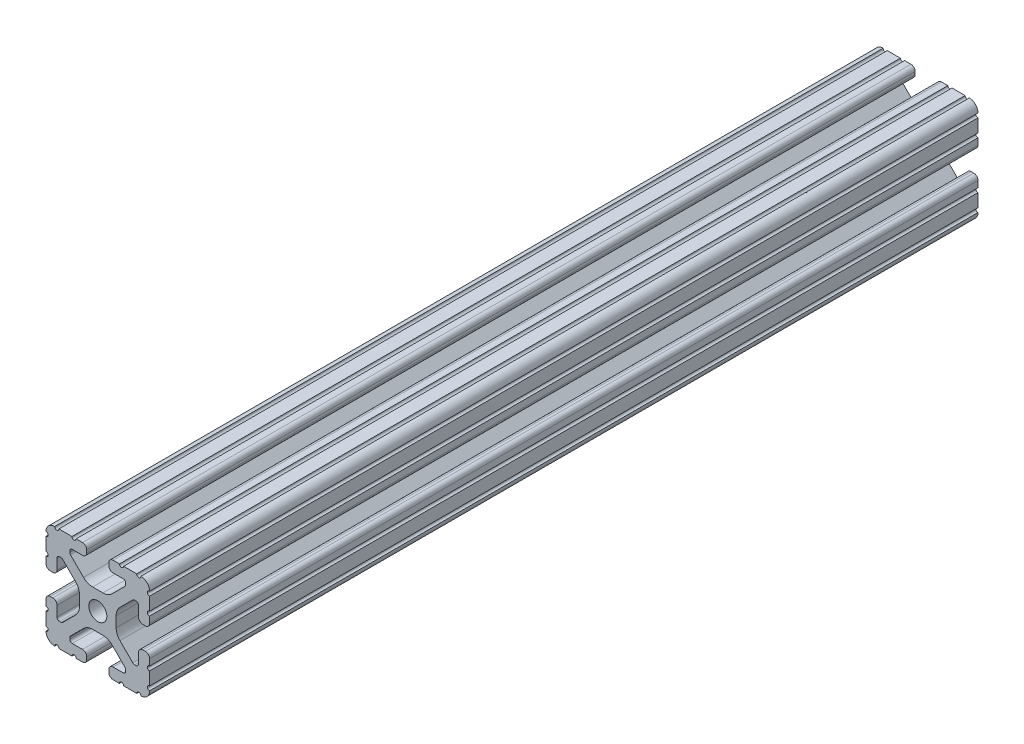
from build123d import *

# Parameters (mm, degrees)
SKETCH1_R           = 3.3274
BOSS_EXTRUDE1_DEPTH = 152.4


with BuildPart() as part:
    # Sketch1 → Boss-Extrude1 (new, symmetric)
    with BuildSketch(Plane.XY):
        with BuildLine():
            Line((-10.287, 13.552357131), (-10.287, 14.0843))
            ThreePointArc((-10.287, 14.0843), (-10.022898185, 14.721898185), (-9.3853, 14.986))
            Line((-9.3853, 14.986), (-5.617617549, 14.986))
            ThreePointArc((-5.617617549, 14.986), (-4.519044045, 15.441044045), (-4.064, 16.539617549))
            Line((-4.064, 16.539617549), (-4.064, 17.496382451))
            ThreePointArc((-4.064, 17.496382451), (-4.519044045, 18.594955955), (-5.617617549, 19.05))
            Line((-5.617617549, 19.05), (-7.974178704, 19.05))
            ThreePointArc((-7.974178704, 19.05), (-8.736178704, 18.288), (-9.498178704, 19.05))
            Line((-9.498178704, 19.05), (-14.327719207, 19.05))
            ThreePointArc((-14.327719207, 19.05), (-15.087603123, 18.231251131), (-15.847487039, 19.05))
            ThreePointArc((-15.847487039, 19.05), (-18.120176289, 18.120192083), (-19.05, 15.847509295))
            ThreePointArc((-19.05, 15.847509295), (-18.231250992, 15.08762539), (-19.05, 14.327741484))
            Line((-19.05, 14.327741484), (-19.05, 9.496091471))
            ThreePointArc((-19.05, 9.496091471), (-18.231250992, 8.736207565), (-19.05, 7.97632366))
            Line((-19.05, 7.97632366), (-19.05, 5.617617549))
            ThreePointArc((-19.05, 5.617617549), (-18.594955955, 4.519044045), (-17.496382451, 4.064))
            Line((-17.496382451, 4.064), (-16.539617549, 4.064))
            ThreePointArc((-16.539617549, 4.064), (-15.441044045, 4.519044045), (-14.986, 5.617617549))
            Line((-14.986, 5.617617549), (-14.986, 9.385342516))
            ThreePointArc((-14.986, 9.385342516), (-14.721898185, 10.022940701), (-14.0843, 10.287042516))
            Line((-14.0843, 10.287042516), (-13.516042086, 10.287042516))
            ThreePointArc((-13.516042086, 10.287042516), (-13.170975923, 10.218404478), (-12.878443117, 10.022939917))
            Line((-12.878443117, 10.022939917), (-8.14758008, 5.292065243))
            ThreePointArc((-8.14758008, 5.292065243), (-7.117955879, 3.751120653), (-6.7564, 1.933453584))
            Line((-6.7564, 1.933453584), (-6.7564, -1.933453584))
            ThreePointArc((-6.7564, -1.933453584), (-7.117955879, -3.751120653), (-8.14758008, -5.292065243))
            Line((-8.14758008, -5.292065243), (-12.878443117, -10.022939917))
            ThreePointArc((-12.878443117, -10.022939917), (-13.170975923, -10.218404478), (-13.516042086, -10.287042516))
            Line((-13.516042086, -10.287042516), (-14.0843, -10.287042516))
            ThreePointArc((-14.0843, -10.287042516), (-14.721898185, -10.022940701), (-14.986, -9.385342516))
            Line((-14.986, -9.385342516), (-14.986, -5.617617549))
            ThreePointArc((-14.986, -5.617617549), (-15.441044045, -4.519044045), (-16.539617549, -4.064))
            Line((-16.539617549, -4.064), (-17.496382451, -4.064))
            ThreePointArc((-17.496382451, -4.064), (-18.594955955, -4.519044045), (-19.05, -5.617617549))
            Line((-19.05, -5.617617549), (-19.05, -7.976318491))
            ThreePointArc((-19.05, -7.976318491), (-18.231250992, -8.736202396), (-19.05, -9.496086302))
            Line((-19.05, -9.496086302), (-19.05, -14.32774291))
            ThreePointArc((-19.05, -14.32774291), (-18.231250992, -15.087626816), (-19.05, -15.847510721))
            ThreePointArc((-19.05, -15.847510721), (-18.120175716, -18.120192644), (-15.847486868, -19.05))
            ThreePointArc((-15.847486868, -19.05), (-15.087602952, -18.231251131), (-14.327719036, -19.05))
            Line((-14.327719036, -19.05), (-9.496062448, -19.05))
            ThreePointArc((-9.496062448, -19.05), (-8.736178532, -18.231251131), (-7.976294616, -19.05))
            Line((-7.976294616, -19.05), (-5.617617549, -19.05))
            ThreePointArc((-5.617617549, -19.05), (-4.519044045, -18.594955955), (-4.064, -17.496382451))
            Line((-4.064, -17.496382451), (-4.064, -16.539617549))
            ThreePointArc((-4.064, -16.539617549), (-4.519044045, -15.441044045), (-5.617617549, -14.986))
            Line((-5.617617549, -14.986), (-9.3853, -14.986))
            ThreePointArc((-9.3853, -14.986), (-10.022898185, -14.721898185), (-10.287, -14.0843))
            Line((-10.287, -14.0843), (-10.287, -13.552357131))
            ThreePointArc((-10.287, -13.552357131), (-10.218362387, -13.207291992), (-10.022898969, -12.91475973))
            Line((-10.022898969, -12.91475973), (-5.252158105, -8.144007132))
            ThreePointArc((-5.252158105, -8.144007132), (-3.715177372, -7.117027388), (-1.902183975, -6.7564))
            Line((-1.902183975, -6.7564), (1.902183975, -6.7564))
            ThreePointArc((1.902183975, -6.7564), (3.715177372, -7.117027388), (5.252158105, -8.144007132))
            Line((5.252158105, -8.144007132), (10.022898969, -12.91475973))
            ThreePointArc((10.022898969, -12.91475973), (10.218362387, -13.207291992), (10.287, -13.552357131))
            Line((10.287, -13.552357131), (10.287, -14.0843))
            ThreePointArc((10.287, -14.0843), (10.022898185, -14.721898185), (9.3853, -14.986))
            Line((9.3853, -14.986), (5.617617549, -14.986))
            ThreePointArc((5.617617549, -14.986), (4.519044045, -15.441044045), (4.064, -16.539617549))
            Line((4.064, -16.539617549), (4.064, -17.496382451))
            ThreePointArc((4.064, -17.496382451), (4.519044045, -18.594955955), (5.617617549, -19.05))
            Line((5.617617549, -19.05), (7.976294616, -19.05))
            ThreePointArc((7.976294616, -19.05), (8.736178532, -18.231251131), (9.496062448, -19.05))
            Line((9.496062448, -19.05), (14.327719036, -19.05))
            ThreePointArc((14.327719036, -19.05), (15.087602952, -18.231251131), (15.847486868, -19.05))
            ThreePointArc((15.847486868, -19.05), (18.120175716, -18.120192644), (19.05, -15.847510721))
            ThreePointArc((19.05, -15.847510721), (18.231250992, -15.087626816), (19.05, -14.32774291))
            Line((19.05, -14.32774291), (19.05, -9.496086302))
            ThreePointArc((19.05, -9.496086302), (18.231250992, -8.736202396), (19.05, -7.976318491))
            Line((19.05, -7.976318491), (19.05, -5.617617549))
            ThreePointArc((19.05, -5.617617549), (18.594955955, -4.519044045), (17.496382451, -4.064))
            Line((17.496382451, -4.064), (16.539617549, -4.064))
            ThreePointArc((16.539617549, -4.064), (15.441044045, -4.519044045), (14.986, -5.617617549))
            Line((14.986, -5.617617549), (14.986, -9.385342516))
            ThreePointArc((14.986, -9.385342516), (14.721898185, -10.022940701), (14.0843, -10.287042516))
            Line((14.0843, -10.287042516), (13.516042086, -10.287042516))
            ThreePointArc((13.516042086, -10.287042516), (13.170975923, -10.218404478), (12.878443117, -10.022939917))
            Line((12.878443117, -10.022939917), (8.14758008, -5.292065243))
            ThreePointArc((8.14758008, -5.292065243), (7.117955879, -3.751120653), (6.7564, -1.933453584))
            Line((6.7564, -1.933453584), (6.7564, 1.933453584))
            ThreePointArc((6.7564, 1.933453584), (7.117955879, 3.751120653), (8.14758008, 5.292065243))
            Line((8.14758008, 5.292065243), (12.878443117, 10.022939917))
            ThreePointArc((12.878443117, 10.022939917), (13.170975923, 10.218404478), (13.516042086, 10.287042516))
            Line((13.516042086, 10.287042516), (14.0843, 10.287042516))
            ThreePointArc((14.0843, 10.287042516), (14.721898185, 10.022940701), (14.986, 9.385342516))
            Line((14.986, 9.385342516), (14.986, 5.617617549))
            ThreePointArc((14.986, 5.617617549), (15.441044045, 4.519044045), (16.539617549, 4.064))
            Line((16.539617549, 4.064), (17.496382451, 4.064))
            ThreePointArc((17.496382451, 4.064), (18.594955955, 4.519044045), (19.05, 5.617617549))
            Line((19.05, 5.617617549), (19.05, 7.97632366))
            ThreePointArc((19.05, 7.97632366), (18.231250992, 8.736207565), (19.05, 9.496091471))
            Line((19.05, 9.496091471), (19.05, 14.327741484))
            ThreePointArc((19.05, 14.327741484), (18.231250992, 15.08762539), (19.05, 15.847509295))
            ThreePointArc((19.05, 15.847509295), (18.120176289, 18.120192083), (15.847487039, 19.05))
            ThreePointArc((15.847487039, 19.05), (15.087603123, 18.231251131), (14.327719207, 19.05))
            Line((14.327719207, 19.05), (9.498178704, 19.05))
            ThreePointArc((9.498178704, 19.05), (8.736178704, 18.288), (7.974178704, 19.05))
            Line((7.974178704, 19.05), (5.617617549, 19.05))
            ThreePointArc((5.617617549, 19.05), (4.519044045, 18.594955955), (4.064, 17.496382451))
            Line((4.064, 17.496382451), (4.064, 16.539617549))
            ThreePointArc((4.064, 16.539617549), (4.519044045, 15.441044045), (5.617617549, 14.986))
            Line((5.617617549, 14.986), (9.3853, 14.986))
            ThreePointArc((9.3853, 14.986), (10.022898185, 14.721898185), (10.287, 14.0843))
            Line((10.287, 14.0843), (10.287, 13.552357131))
            ThreePointArc((10.287, 13.552357131), (10.218362387, 13.207291992), (10.022898969, 12.91475973))
            Line((10.022898969, 12.91475973), (5.252158105, 8.144007132))
            ThreePointArc((5.252158105, 8.144007132), (3.715177372, 7.117027388), (1.902183975, 6.7564))
            Line((1.902183975, 6.7564), (-1.902183975, 6.7564))
            ThreePointArc((-1.902183975, 6.7564), (-3.715177372, 7.117027388), (-5.252158105, 8.144007132))
            Line((-5.252158105, 8.144007132), (-10.022898969, 12.91475973))
            ThreePointArc((-10.022898969, 12.91475973), (-10.218362387, 13.207291992), (-10.287, 13.552357131))
        make_face()
        with Locations(Location((0, 0, 0), (0, 0, 180))):
            Circle(SKETCH1_R, mode=Mode.SUBTRACT)
    extrude(amount=BOSS_EXTRUDE1_DEPTH, both=True)


solid = part.part
